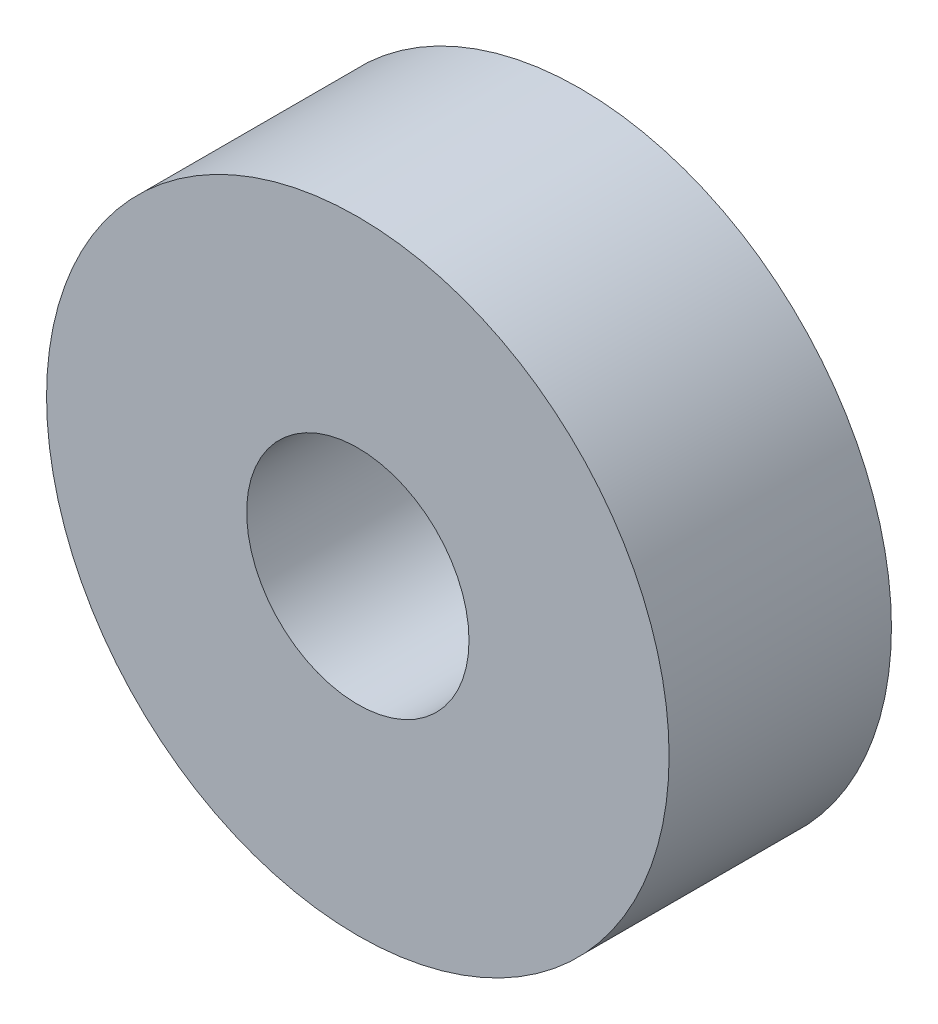
from build123d import *

# Parameters (mm, degrees)
ESQUISSE1_R        = 7
ESQUISSE1_R_2      = 2.5
BOSS_EXTRU_1_DEPTH = 5


with BuildPart() as part:
    # Esquisse1 → Boss.-Extru.1 (new body)
    with BuildSketch(Plane.XY):
        Circle(ESQUISSE1_R)
        Circle(ESQUISSE1_R_2, mode=Mode.SUBTRACT)
    extrude(amount=BOSS_EXTRU_1_DEPTH)


solid = part.part
